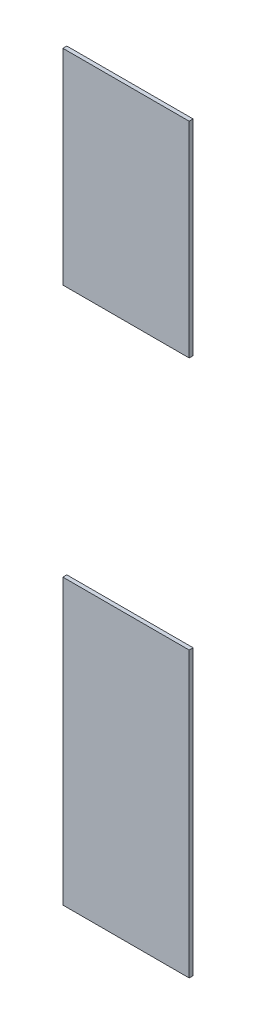
from build123d import *

# Parameters (mm, degrees)
SKETCH_1_W        = 400
SKETCH_1_H        = 649.25
EXTRUDE_1_DEPTH   = 12.5
SKETCH_1_H_2      = 899.25
EXTRUDE_1_2_DEPTH = 12.5


with BuildPart() as part:
    # Эскиз1 → Бобышка-Вытянуть1 (new body)
    with BuildSketch(Plane.XY):
        with Locations((200, -324.625)):
            Rectangle(SKETCH_1_W, SKETCH_1_H)
    extrude(amount=EXTRUDE_1_DEPTH)


with BuildPart() as body_2:
    # Эскиз1 → Extrude 1 2 (new body)
    with BuildSketch(Plane.XY):
        with Locations((200, -1899.625)):
            Rectangle(SKETCH_1_W, SKETCH_1_H_2)
    extrude(amount=EXTRUDE_1_2_DEPTH)


solid = Compound([part.part, body_2.part])
